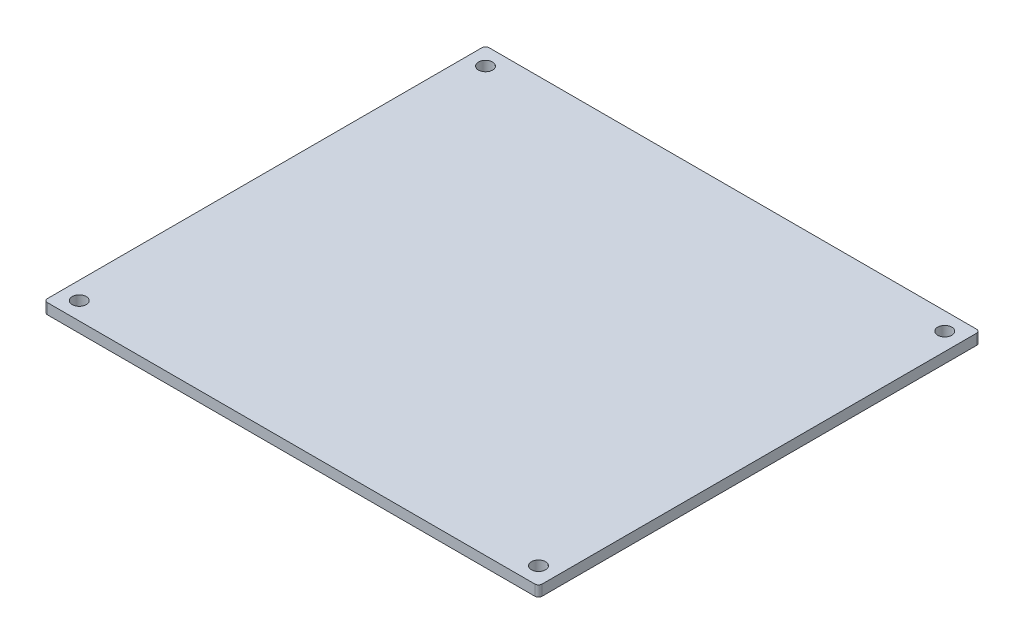
from build123d import *

# Parameters (mm, degrees)
SKETCH1_W           = 280
SKETCH1_H           = 250
BOSS_EXTRUDE1_DEPTH = 6
FILLET1_R           = 2
SKETCH2_R           = 4
CUT_EXTRUDE1_DEPTH  = 188.77912557


with BuildPart() as part:
    # Sketch1 → Boss-Extrude1 (new body)
    with BuildSketch(Plane(origin=(0, 0, 0), x_dir=(1, 0, 0), z_dir=(0, 1, 0))):
        Rectangle(SKETCH1_W, SKETCH1_H)
    extrude(amount=BOSS_EXTRUDE1_DEPTH)

    # Fillet1
    fillet1_edges = [part.edges().sort_by_distance(p)[0] for p in [
        (140, 3, -125),
        (140, 3, 125),
        (-140, 3, 125),
        (-140, 3, -125),
    ]]
    fillet(fillet1_edges, radius=FILLET1_R)

    # Sketch2 → Cut-Extrude1 (cut, through all)
    with BuildSketch(Plane(origin=(0, 6, 0), x_dir=(1, 0, 0), z_dir=(0, 1, 0))):
        with Locations(Location((-130, 115, 0), (0, 0, 270))):
            Circle(SKETCH2_R)
        with Locations(Location((130, 115, 0), (0, 0, 270))):
            Circle(SKETCH2_R)
        with Locations(Location((130, -115, 0), (0, 0, 270))):
            Circle(SKETCH2_R)
        with Locations(Location((-130, -115, 0), (0, 0, 270))):
            Circle(SKETCH2_R)
    extrude(amount=-CUT_EXTRUDE1_DEPTH, mode=Mode.SUBTRACT)


solid = part.part
